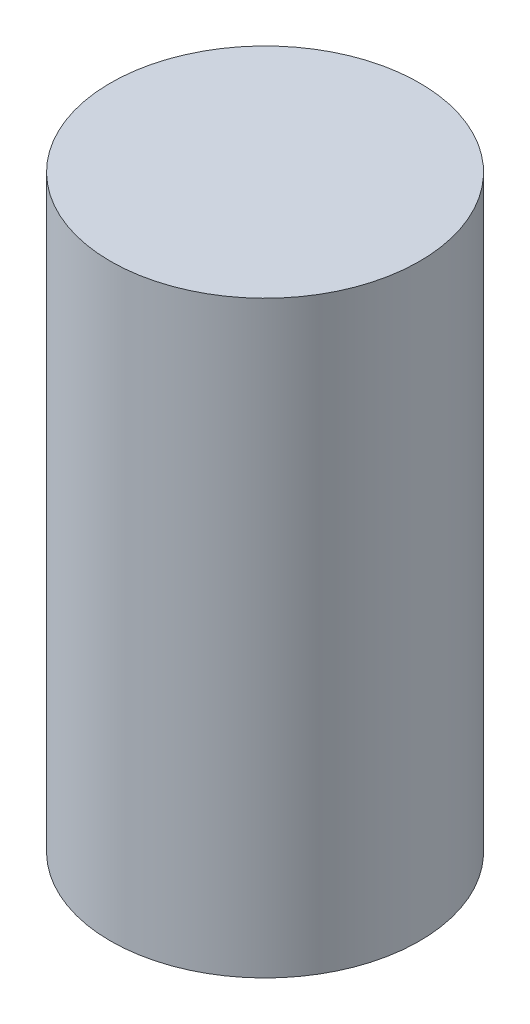
from build123d import *

# Parameters (mm, degrees)
SKETCH1_R           = 10.5
BOSS_EXTRUDE1_DEPTH = 40


with BuildPart() as part:
    # Sketch1 → Boss-Extrude1 (new body)
    with BuildSketch(Plane(origin=(0, 0, 0), x_dir=(1, 0, 0), z_dir=(0, 1, 0))):
        with Locations(Location((0, 0, 0), (0, 0, 270))):
            Circle(SKETCH1_R)
    extrude(amount=BOSS_EXTRUDE1_DEPTH)


solid = part.part
